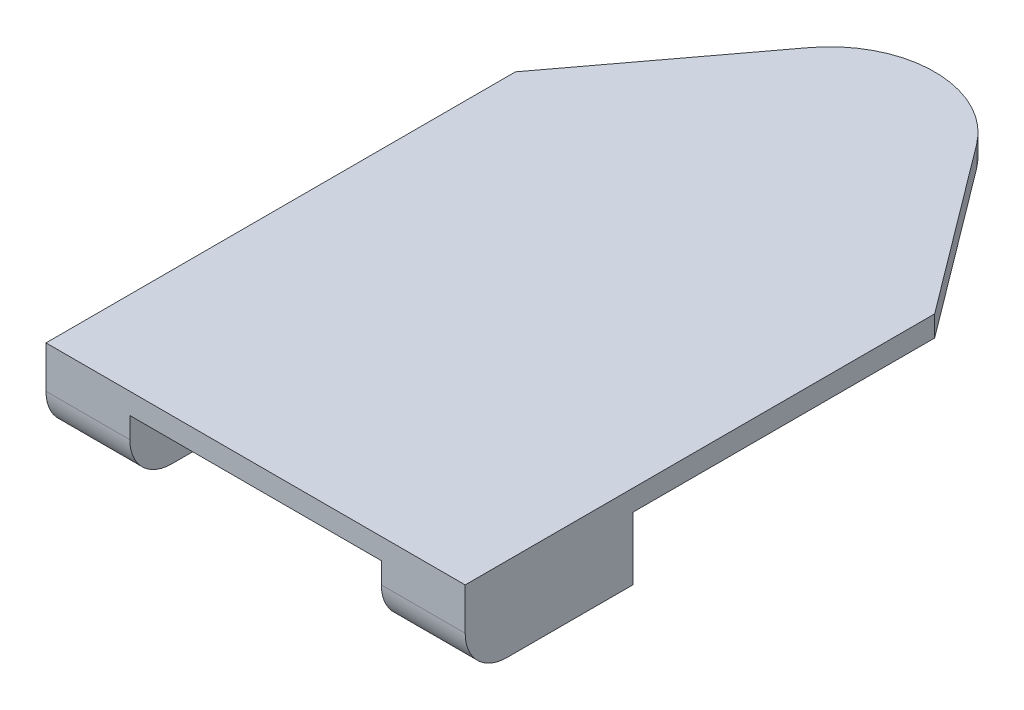
from build123d import *

# Parameters (mm, degrees)
EXTRUDE_1_DEPTH = 5
SKETCH_2_W      = 20
SKETCH_2_H      = 40
EXTRUDE_3_DEPTH = 15
FILLET_1_R      = 10


with BuildPart() as part:
    # 草图1 → 凸台-拉伸1 (new body)
    with BuildSketch(Plane(origin=(0, 0, 0), x_dir=(1, 0, 0), z_dir=(0, 1, 0))):
        with BuildLine():
            Line((0, 0), (100, 0))
            Line((100, 0), (100, 112))
            Line((100, 112), (70, 152))
            ThreePointArc((70, 152), (50, 162), (30, 152))
            Line((30, 152), (0, 112))
            Line((0, 112), (0, 0))
        make_face()
    extrude(amount=EXTRUDE_1_DEPTH)

    # 草图2 → 凸台-拉伸3 (add)
    with BuildSketch(Plane.XZ):
        with Locations((90, -20)):
            Rectangle(SKETCH_2_W, SKETCH_2_H)
        with Locations((10, -20)):
            Rectangle(SKETCH_2_W, SKETCH_2_H)
    extrude(amount=EXTRUDE_3_DEPTH)

    # 圆角1
    fillet_1_edges = [part.edges().sort_by_distance(p)[0] for p in [
        (90, -15, 0),
        (10, -15, 0),
    ]]
    fillet(fillet_1_edges, radius=FILLET_1_R)


solid = part.part
